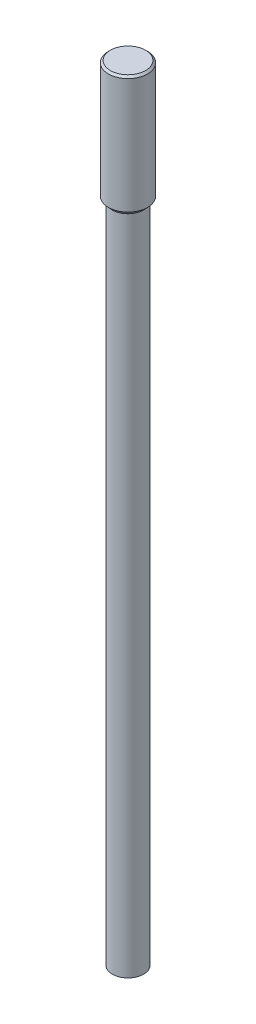
from build123d import *

# Parameters (mm, degrees)
SFAZOWANIE1_SIZE = 0.5


with BuildPart() as part:
    # Szkic1 → Obrót1 (revolve)
    with BuildSketch(Plane.XY):
        Polygon((0, 109.917798467), (-5, 109.917798467), (-5, 79.917798467), (-4, 78.836762231), (-4, -90.082201533), (0, -90.082201533), align=None)
    revolve(axis=Axis((0, 109.917798467, 0), (0, -1, 0)))

    # Sfazowanie1
    sfazowanie1_edges = [part.edges().sort_by_distance(p)[0] for p in [
        (5, 109.917798467, 0),
    ]]
    chamfer(sfazowanie1_edges, length=SFAZOWANIE1_SIZE)


solid = part.part
